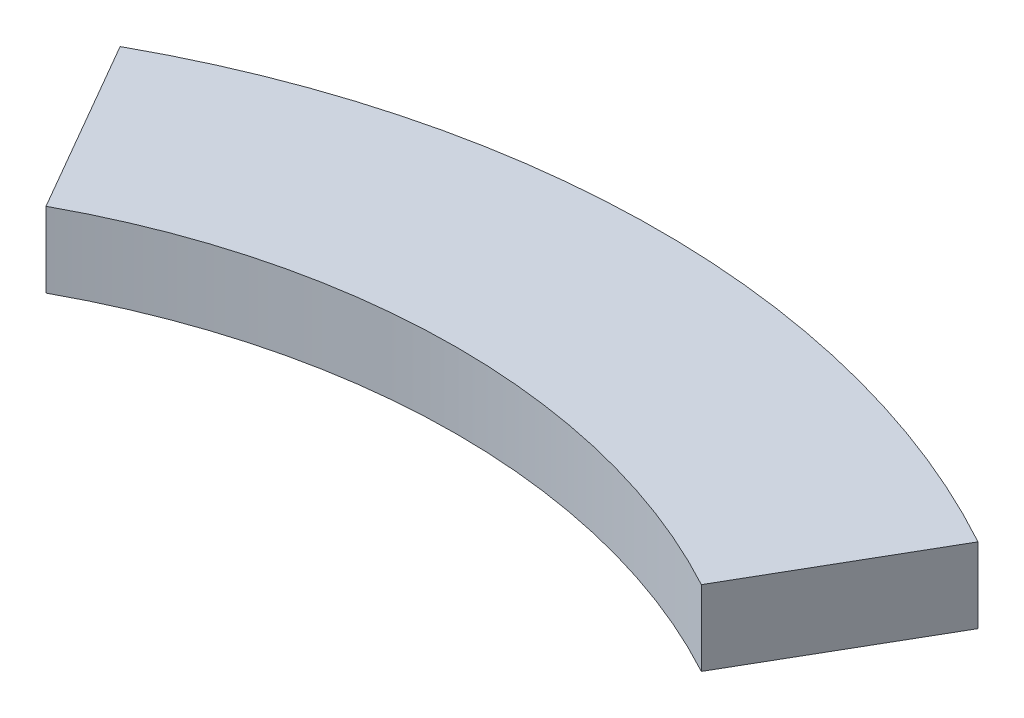
from build123d import *

# Parameters (mm, degrees)
BOSS_EXTRUDE1_DEPTH = 3.15
SKETCH2_R           = 1.625
CUT_EXTRUDE1_DEPTH  = 2


with BuildPart() as part:
    # Sketch1 → Boss-Extrude1 (new body)
    with BuildSketch(Plane(origin=(0, 0, 0), x_dir=(1, 0, 0), z_dir=(0, 1, 0))):
        with BuildLine():
            Line((-17.971705397, 32.627906846), (-13.729256498, 25.279769804))
            ThreePointArc((-13.729256498, 25.279769804), (0, 28.767329478), (13.729256498, 25.279769804))
            Line((13.729256498, 25.279769804), (17.971705397, 32.627906846))
            ThreePointArc((17.971705397, 32.627906846), (0, 37.25), (-17.971705397, 32.627906846))
        make_face()
    extrude(amount=BOSS_EXTRUDE1_DEPTH)

    # Sketch2 → Cut-Extrude1 (cut)
    with BuildSketch(Plane.XZ):
        with Locations(Location((0, -33.008664739, 0), (0, 0, 270))):
            Circle(SKETCH2_R)
    extrude(amount=-CUT_EXTRUDE1_DEPTH, mode=Mode.SUBTRACT)


solid = part.part
